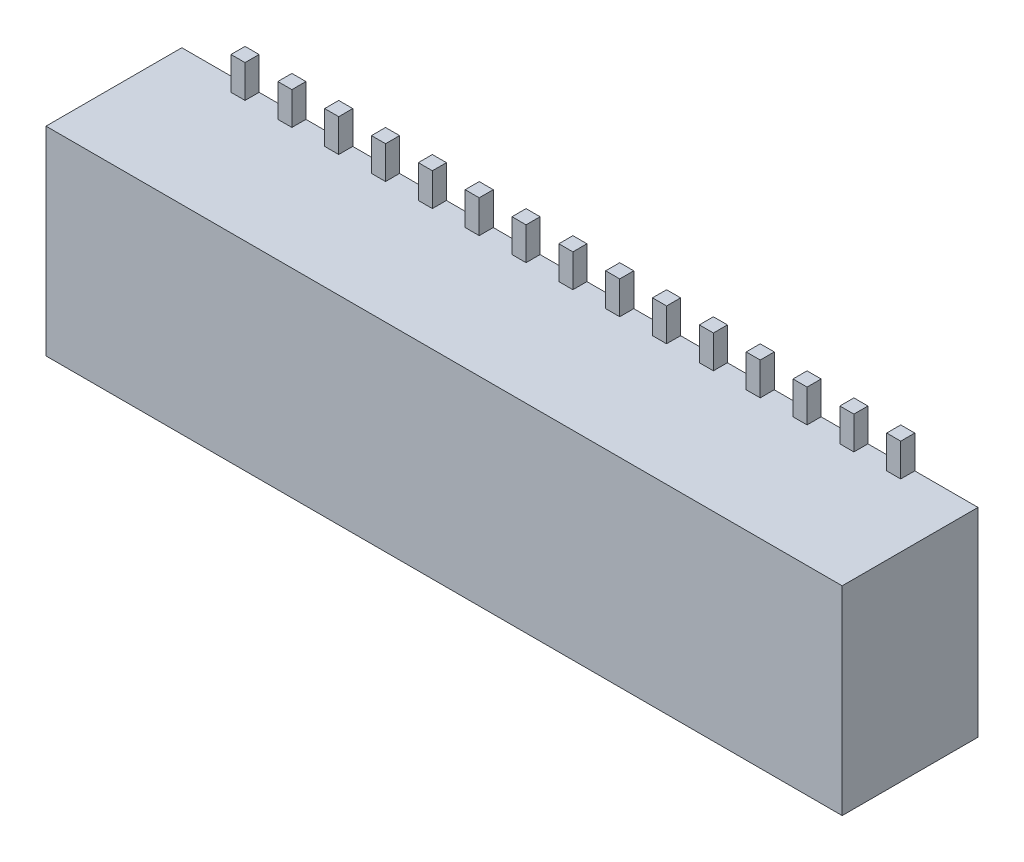
from build123d import *

# Parameters (mm, degrees)
SKETCH1_W           = 17
SKETCH1_H           = 4.25
BOSS_EXTRUDE1_DEPTH = 2.9
SKETCH2_W           = 15.4
SKETCH2_H           = 1.9
CUT_EXTRUDE1_DEPTH  = 2.9
SKETCH3_W           = 0.3
SKETCH3_H           = 0.6
BOSS_EXTRUDE2_DEPTH = 2.5
SKETCH4_W           = 0.3
SKETCH4_H           = 0.8
BOSS_EXTRUDE3_DEPTH = 0.3


with BuildPart() as part:
    # Sketch1 → Boss-Extrude1 (new body)
    with BuildSketch(Plane.XY):
        Rectangle(SKETCH1_W, SKETCH1_H)
    extrude(amount=BOSS_EXTRUDE1_DEPTH)

    # Sketch2 → Cut-Extrude1 (cut)
    with BuildSketch(Plane.XZ.offset(2.125)):
        with Locations((0, 1.45)):
            Rectangle(SKETCH2_W, SKETCH2_H)
    extrude(amount=-CUT_EXTRUDE1_DEPTH, mode=Mode.SUBTRACT)

    # Sketch3 → Boss-Extrude2 (add)
    with BuildSketch(Plane.XZ.offset(-0.775)):
        with Locations((-7, 1.45)):
            Rectangle(SKETCH3_W, SKETCH3_H)
        with Locations((-6, 1.45)):
            Rectangle(SKETCH3_W, SKETCH3_H)
        with Locations((-5, 1.45)):
            Rectangle(SKETCH3_W, SKETCH3_H)
        with Locations((-4, 1.45)):
            Rectangle(SKETCH3_W, SKETCH3_H)
        with Locations((-3, 1.45)):
            Rectangle(SKETCH3_W, SKETCH3_H)
        with Locations((-2, 1.45)):
            Rectangle(SKETCH3_W, SKETCH3_H)
        with Locations((-1, 1.45)):
            Rectangle(SKETCH3_W, SKETCH3_H)
        with Locations((0, 1.45)):
            Rectangle(SKETCH3_W, SKETCH3_H)
        with Locations((1, 1.45)):
            Rectangle(SKETCH3_W, SKETCH3_H)
        with Locations((2, 1.45)):
            Rectangle(SKETCH3_W, SKETCH3_H)
        with Locations((3, 1.45)):
            Rectangle(SKETCH3_W, SKETCH3_H)
        with Locations((4, 1.45)):
            Rectangle(SKETCH3_W, SKETCH3_H)
        with Locations((5, 1.45)):
            Rectangle(SKETCH3_W, SKETCH3_H)
        with Locations((6, 1.45)):
            Rectangle(SKETCH3_W, SKETCH3_H)
        with Locations((7, 1.45)):
            Rectangle(SKETCH3_W, SKETCH3_H)
    extrude(amount=BOSS_EXTRUDE2_DEPTH)

    # Sketch4 → Boss-Extrude3 (add)
    with BuildSketch(Plane(origin=(0, 0, 0), x_dir=(-1, 0, 0), z_dir=(0, 0, -1))):
        with Locations((-7, 2.425)):
            Rectangle(SKETCH4_W, SKETCH4_H)
        with Locations((-6, 2.425)):
            Rectangle(SKETCH4_W, SKETCH4_H)
        with Locations((-5, 2.425)):
            Rectangle(SKETCH4_W, SKETCH4_H)
        with Locations((-4, 2.425)):
            Rectangle(SKETCH4_W, SKETCH4_H)
        with Locations((-3, 2.425)):
            Rectangle(SKETCH4_W, SKETCH4_H)
        with Locations((-2, 2.425)):
            Rectangle(SKETCH4_W, SKETCH4_H)
        with Locations((-1, 2.425)):
            Rectangle(SKETCH4_W, SKETCH4_H)
        with Locations((0, 2.425)):
            Rectangle(SKETCH4_W, SKETCH4_H)
        with Locations((1, 2.425)):
            Rectangle(SKETCH4_W, SKETCH4_H)
        with Locations((2, 2.425)):
            Rectangle(SKETCH4_W, SKETCH4_H)
        with Locations((3, 2.425)):
            Rectangle(SKETCH4_W, SKETCH4_H)
        with Locations((4, 2.425)):
            Rectangle(SKETCH4_W, SKETCH4_H)
        with Locations((5, 2.425)):
            Rectangle(SKETCH4_W, SKETCH4_H)
        with Locations((6, 2.425)):
            Rectangle(SKETCH4_W, SKETCH4_H)
        with Locations((7, 2.425)):
            Rectangle(SKETCH4_W, SKETCH4_H)
    extrude(amount=-BOSS_EXTRUDE3_DEPTH)


solid = part.part
